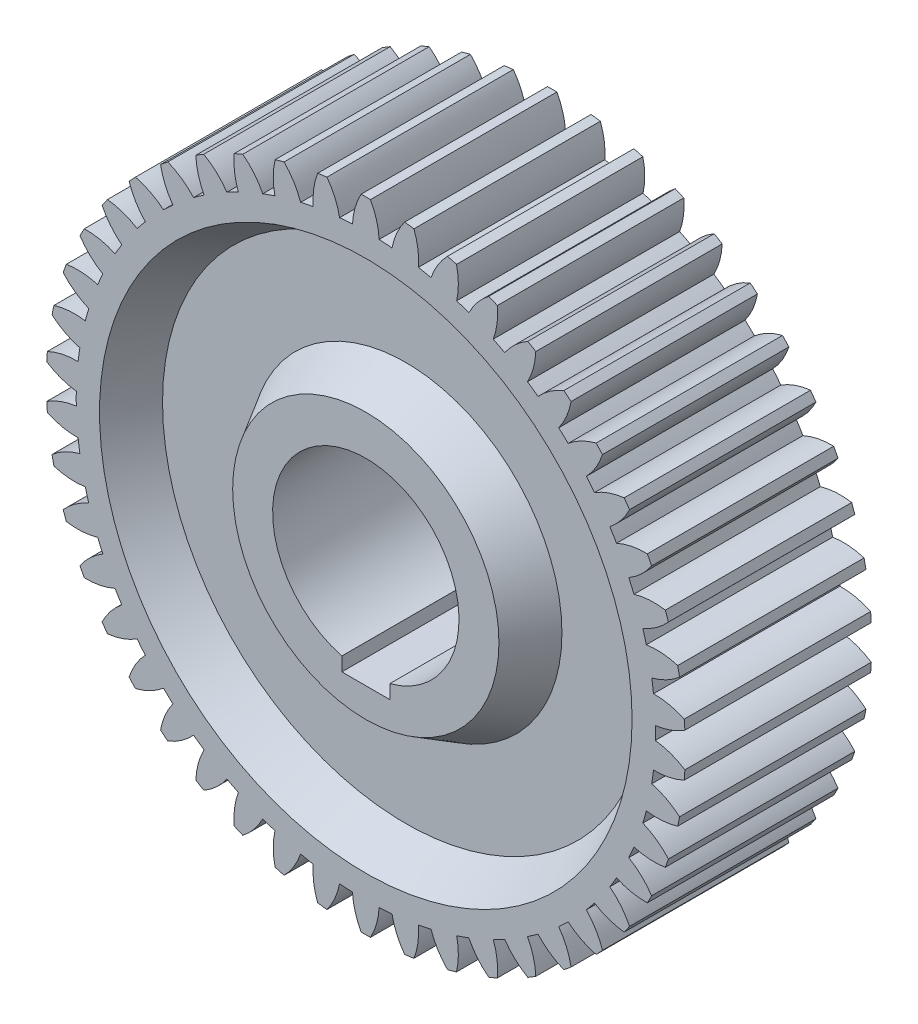
from build123d import *

# Parameters (mm, degrees)
SKETCH_1_R                 = 217.5
EXTRUDE_1_DEPTH            = 70
EXTRUDE_2_DEPTH            = 70
PATTERN_CIRCULAR_1_COUNT   = 46
CUT_EXTRUDE_1_DEPTH        = 367.925042979
SKETCH_4_R                 = 200
SKETCH_4_R_2               = 100
CUT_EXTRUDE_2_DEPTH        = 30
CUT_EXTRUDE_2_DRAFT        = 30
MIRROR_1_COPY_1_SKETCH_R   = 200
MIRROR_1_COPY_1_SKETCH_R_2 = 100
MIRROR_1_COPY_1_DEPTH      = 30
MIRROR_1_COPY_1_DRAFT      = 30


with BuildPart() as part:
    # 草图1 → 拉伸1 (new, symmetric)
    with BuildSketch(Plane.XY):
        Circle(SKETCH_1_R)
    extrude(amount=EXTRUDE_1_DEPTH, both=True)

    # 草图2 → 拉伸2 (add, symmetric)
    with BuildSketch(Plane.XY):
        with BuildLine():
            ThreePointArc((10, 217.269993326), (0, 217.5), (-10, 217.269993326))
            ThreePointArc((-10, 217.269993326), (-8.036010682, 228.990403779), (-3.5, 239.97447781))
            ThreePointArc((-3.5, 239.97447781), (0, 240), (3.5, 239.97447781))
            ThreePointArc((3.5, 239.97447781), (8.036010682, 228.990403779), (10, 217.269993326))
        make_face()
    extrude_2 = extrude(amount=EXTRUDE_2_DEPTH, both=True)

    # 阵列(圆周)1: 拉伸2 ×46 about axis
    pattern_circular_1_axis = Axis((0, 0, 0), (0, 0, 1))
    for i in range(1, PATTERN_CIRCULAR_1_COUNT):
        add(extrude_2.rotate(pattern_circular_1_axis, i * 360 / PATTERN_CIRCULAR_1_COUNT))

    # 草图3 → 切除-拉伸1 (cut, through all)
    with BuildSketch(Plane.XY.offset(-70)):
        with BuildLine():
            Line((-18, -67.646138101), (-18, -78))
            Line((-18, -78), (18, -78))
            Line((18, -78), (18, -67.646138101))
            ThreePointArc((18, -67.646138101), (0, 70), (-18, -67.646138101))
        make_face()
    extrude(amount=CUT_EXTRUDE_1_DEPTH, mode=Mode.SUBTRACT)


with BuildPart() as cut_extrude_2_tool:
    # 草图4 → 切除-拉伸2 (with draft: the straight prism first)
    with BuildSketch(Plane.XY.offset(-70)):
        Circle(SKETCH_4_R)
        Circle(SKETCH_4_R_2, mode=Mode.SUBTRACT)
    extrude(amount=CUT_EXTRUDE_2_DEPTH)
    # 切除-拉伸2: the draft: its side faces are tilted about the plane it starts from
    cut_extrude_2_sides = [cut_extrude_2_tool.faces().sort_by_distance(p)[0] for p in [
        (-200, 0, -55),
        (-100, 0, -55),
    ]]
    draft(cut_extrude_2_sides, Plane.XY.offset(-70), CUT_EXTRUDE_2_DRAFT)


with BuildPart() as part_1:
    add(part.part)

    # 切除-拉伸2: cut by cut_extrude_2_tool
    add(cut_extrude_2_tool.part, mode=Mode.SUBTRACT)


with BuildPart() as mirror_1_copy_1_tool:
    # 镜向1 copy 1 sketch → 镜向1 copy 1 (with draft: the straight prism first)
    with BuildSketch(Plane(origin=(0, 0, 70), x_dir=(1, 0, 0), z_dir=(0, 0, -1))):
        Circle(MIRROR_1_COPY_1_SKETCH_R)
        Circle(MIRROR_1_COPY_1_SKETCH_R_2, mode=Mode.SUBTRACT)
    extrude(amount=MIRROR_1_COPY_1_DEPTH)
    # 镜向1 copy 1: the draft: its side faces are tilted about the plane it starts from
    mirror_1_copy_1_sides = [mirror_1_copy_1_tool.faces().sort_by_distance(p)[0] for p in [
        (-200, 0, 55),
        (-100, 0, 55),
    ]]
    draft(mirror_1_copy_1_sides, Plane(origin=(0, 0, 70), x_dir=(1, 0, 0), z_dir=(0, 0, -1)), MIRROR_1_COPY_1_DRAFT)


with BuildPart() as part_2:
    add(part_1.part)

    # 镜向1 copy 1: cut by mirror_1_copy_1_tool
    add(mirror_1_copy_1_tool.part, mode=Mode.SUBTRACT)


solid = part_2.part
